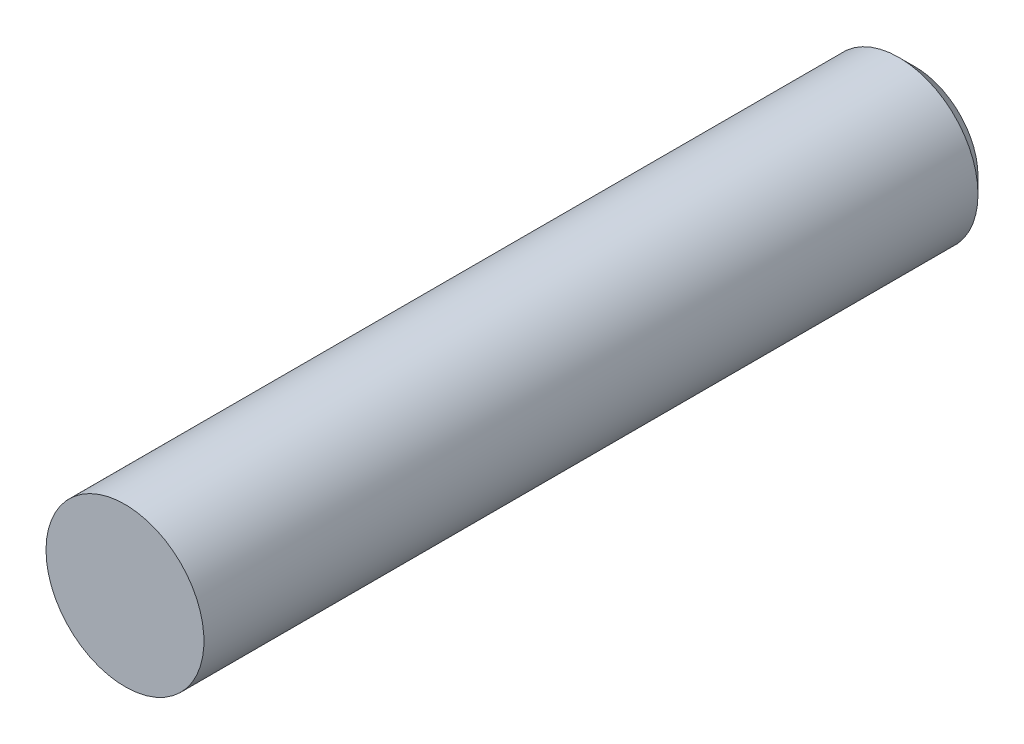
from build123d import *

# Parameters (mm, degrees)
SKETCH1_R          = 2.5
EXTRUDE1_DEPTH     = 100
CHAMFER1_SIZE      = 0.5
SKETCH3_W          = 19.542499602
SKETCH3_H          = 13.436538206
CUT_EXTRUDE1_DEPTH = 175


with BuildPart() as part:
    # Sketch1 → Extrude1 (new, symmetric)
    with BuildSketch(Plane.XY):
        Circle(SKETCH1_R)
    extrude(amount=EXTRUDE1_DEPTH, both=True)

    # Chamfer1
    chamfer1_edges = [part.edges().sort_by_distance(p)[0] for p in [
        (-2.5, 0, -100),
        (-2.5, 0, 100),
    ]]
    chamfer(chamfer1_edges, length=CHAMFER1_SIZE)

    # Sketch3 → Cut-Extrude1 (cut)
    with BuildSketch(Plane.XY.offset(100)):
        Rectangle(SKETCH3_W, SKETCH3_H)
    extrude(amount=-CUT_EXTRUDE1_DEPTH, mode=Mode.SUBTRACT)


solid = part.part
